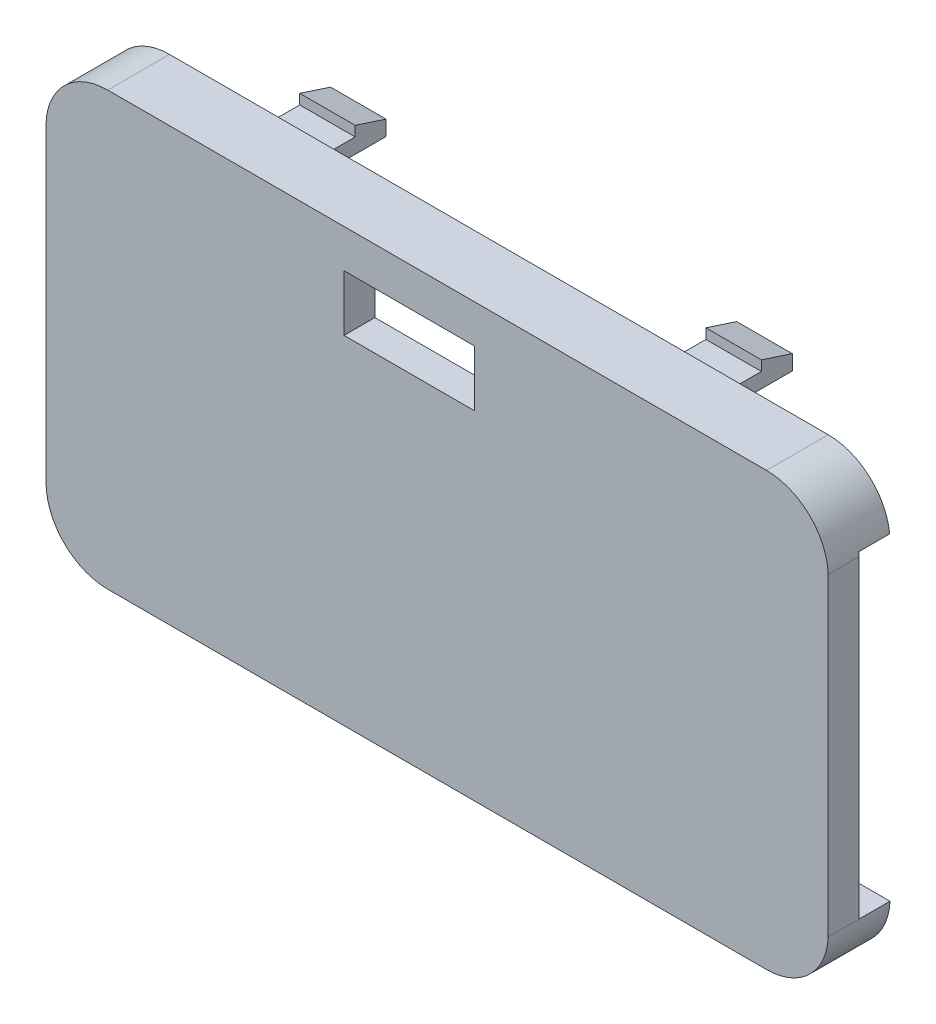
from build123d import *

# Parameters (mm, degrees)
EXTRUDE_1_DEPTH     = 1.5
EXTRUDE_2_DEPTH     = 1.5
CUT_EXTRUDE_2_DEPTH = 1.5
SKETCH_8_W          = 6.342405544
SKETCH_8_H          = 2.722912939
CUT_EXTRUDE_3_DEPTH = 1.5
SKETCH_9_W          = 2.696269273
SKETCH_9_H          = 0.7312398
EXTRUDE_4_DEPTH     = 3
EXTRUDE_6_REACH     = 61.436
CUT_EXTRUDE_4_DEPTH = 17.033846789
SKETCH_6_W          = 3.802870335
SKETCH_6_H          = 10.25
CUT_EXTRUDE_5_DEPTH = 3.024817901


with BuildPart() as part:
    # 草图1 → 凸台-拉伸1 (new body)
    with BuildSketch(Plane.XY.offset(46.24708128)):
        with BuildLine():
            Line((-18.935673231, -7.132078693), (13.064326769, -7.132078693))
            ThreePointArc((13.064326769, -7.132078693), (15.140982735, -6.297142202), (16.061721471, -4.257078693))
            Line((16.061721471, -4.257078693), (16.061721471, 10.992921307))
            ThreePointArc((16.061721471, 10.992921307), (15.140982735, 13.032984817), (13.064326769, 13.867921307))
            Line((13.064326769, 13.867921307), (-18.935673231, 13.867921307))
            ThreePointArc((-18.935673231, 13.867921307), (-21.056993574, 12.989241651), (-21.935673231, 10.867921307))
            Line((-21.935673231, 10.867921307), (-21.935673231, -4.132078693))
            ThreePointArc((-21.935673231, -4.132078693), (-21.056993574, -6.253399036), (-18.935673231, -7.132078693))
        make_face()
        with BuildLine():
            Line((13.064326769, -5.632078693), (-18.935673231, -5.632078693))
            ThreePointArc((-18.935673231, -5.632078693), (-19.996333403, -5.192738865), (-20.435673231, -4.132078693))
            Line((-20.435673231, -4.132078693), (-20.435673231, 10.867921307))
            ThreePointArc((-20.435673231, 10.867921307), (-19.996333403, 11.928581479), (-18.935673231, 12.367921307))
            Line((-18.935673231, 12.367921307), (13.064326769, 12.367921307))
            ThreePointArc((13.064326769, 12.367921307), (14.124986941, 11.928581479), (14.564326769, 10.867921307))
            Line((14.564326769, 10.867921307), (14.564326769, -4.132078693))
            ThreePointArc((14.564326769, -4.132078693), (14.124986941, -5.192738865), (13.064326769, -5.632078693))
        make_face(mode=Mode.SUBTRACT)
    extrude(amount=EXTRUDE_1_DEPTH)

    # 草图4 → 凸台-拉伸2 (add)
    with BuildSketch(Plane.XY.offset(47.74708128)):
        with BuildLine():
            Line((-21.935673231, 10.867921307), (-21.935673231, -4.132078693))
            ThreePointArc((-21.935673231, -4.132078693), (-21.056993574, -6.253399036), (-18.935673231, -7.132078693))
            Line((-18.935673231, -7.132078693), (13.064326769, -7.132078693))
            ThreePointArc((13.064326769, -7.132078693), (15.140982735, -6.297142202), (16.061721471, -4.257078693))
            Line((16.061721471, -4.257078693), (16.061721471, 10.992921307))
            ThreePointArc((16.061721471, 10.992921307), (15.140982735, 13.032984817), (13.064326769, 13.867921307))
            Line((13.064326769, 13.867921307), (-18.935673231, 13.867921307))
            ThreePointArc((-18.935673231, 13.867921307), (-21.056993574, 12.989241651), (-21.935673231, 10.867921307))
        make_face()
    extrude(amount=EXTRUDE_2_DEPTH)

    # 草图7 → 切除-拉伸2 (cut)
    with BuildSketch(Plane(origin=(16.061721471, 0, 0), x_dir=(0, 0, -1), z_dir=(1, 0, 0))):
        Polygon((-46.24708128, 11.189366068), (-47.753743169, 11.189366068), (-47.74708128, -4.257078693), (-46.24708128, -4.257078693), align=None)
    extrude(amount=-CUT_EXTRUDE_2_DEPTH, mode=Mode.SUBTRACT)

    # 草图8 → 切除-拉伸3 (cut)
    with BuildSketch(Plane.XY.offset(49.24708128)):
        with Locations((-4.288714371, 10.645412295)):
            Rectangle(SKETCH_8_W, SKETCH_8_H)
    extrude(amount=-CUT_EXTRUDE_3_DEPTH, mode=Mode.SUBTRACT)

    # 草图9 → 凸台-拉伸4 (add)
    with BuildSketch(Plane(origin=(0, 0, 46.24708128), x_dir=(-1, 0, 0), z_dir=(0, 0, -1))):
        with Locations((-6.965713307, 13.038581452)):
            Rectangle(SKETCH_9_W, SKETCH_9_H)
        with Locations((12.764402756, 13.038581452)):
            Rectangle(SKETCH_9_W, SKETCH_9_H)
        with Locations((12.764402756, -6.302738837)):
            Rectangle(SKETCH_9_W, SKETCH_9_H)
        with Locations((-6.965713307, -6.302738837)):
            Rectangle(SKETCH_9_W, SKETCH_9_H)
    extrude(amount=EXTRUDE_4_DEPTH)

    # 凸台-拉伸6: up to this face of the body (flat: up to its plane)
    extrude_6_end = Plane(part.part.faces().sort_by_distance((-14.112537392, 13.038581452, 44.74708128))[0])
    # 草图10 → 凸台-拉伸6 (add, up to the picked face)
    with BuildSketch(Plane(origin=(8.313847943, 0, 0), x_dir=(0, 0, -1), z_dir=(1, 0, 0)), mode=Mode.PRIVATE) as extrude_6_sk1:
        Polygon((-44.74708128, 13.404201352), (-44.74708128, 13.89248872), (-43.24708128, 13.404201352), align=None)
    extrude_6_tool1 = split(extrude(extrude_6_sk1.sketch, amount=-EXTRUDE_6_REACH, mode=Mode.PRIVATE), bisect_by=extrude_6_end, keep=Keep.BOTH, mode=Mode.PRIVATE)
    extrude_6 = extrude_6_tool1.solids().sort_by(Axis((8.313848, 13.566964, 44.247081), (-1, 0, 0)))[0]
    add(extrude_6)

    # 草图11 → 切除-拉伸4 (cut)
    with BuildSketch(Plane(origin=(-11.416268119, 0, 0), x_dir=(0, 0, -1), z_dir=(1, 0, 0))):
        Polygon((-44.74708128, 13.404201352), (-43.24708128, 13.404201352), (-44.74708128, 13.89248872), align=None)
    cut_extrude_4 = extrude(amount=CUT_EXTRUDE_4_DEPTH, mode=Mode.SUBTRACT)

    # 镜向1: 凸台-拉伸6 across plane
    add(extrude_6.mirror(Plane(origin=(0, 3.367921307, 0), x_dir=(0, 0, 1), z_dir=(0, -1, 0))))

    # 镜向2: 切除-拉伸4 across plane
    add(cut_extrude_4.mirror(Plane(origin=(0, 3.367921307, 0), x_dir=(0, 0, 1), z_dir=(0, -1, 0))), mode=Mode.SUBTRACT)

    # 草图6 → 切除-拉伸5 (cut)
    with BuildSketch(Plane.ZY.offset(21.935673231)):
        with Locations((46.829796448, 3.511921307)):
            Rectangle(SKETCH_6_W, SKETCH_6_H)
    extrude(amount=-CUT_EXTRUDE_5_DEPTH, mode=Mode.SUBTRACT)


solid = part.part
